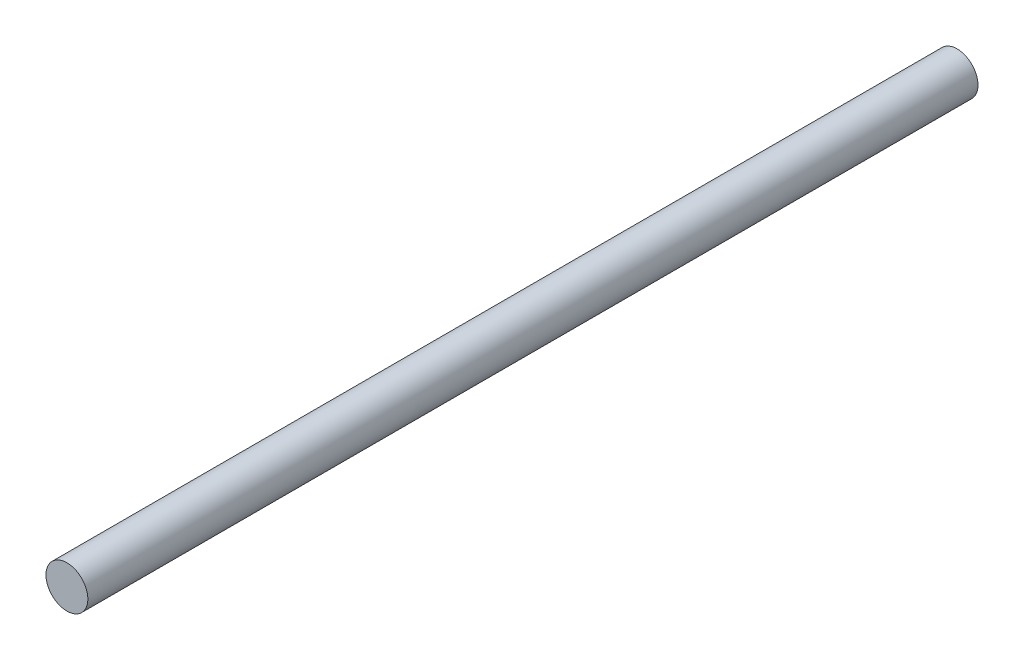
from build123d import *

# Parameters (mm, degrees)
SKETCH_1_R      = 2
EXTRUDE_1_DEPTH = 85


with BuildPart() as part:
    # Sketch 1 → 凸台-拉伸1 (new body)
    with BuildSketch(Plane.XY):
        Circle(SKETCH_1_R)
    extrude(amount=EXTRUDE_1_DEPTH)


solid = part.part
